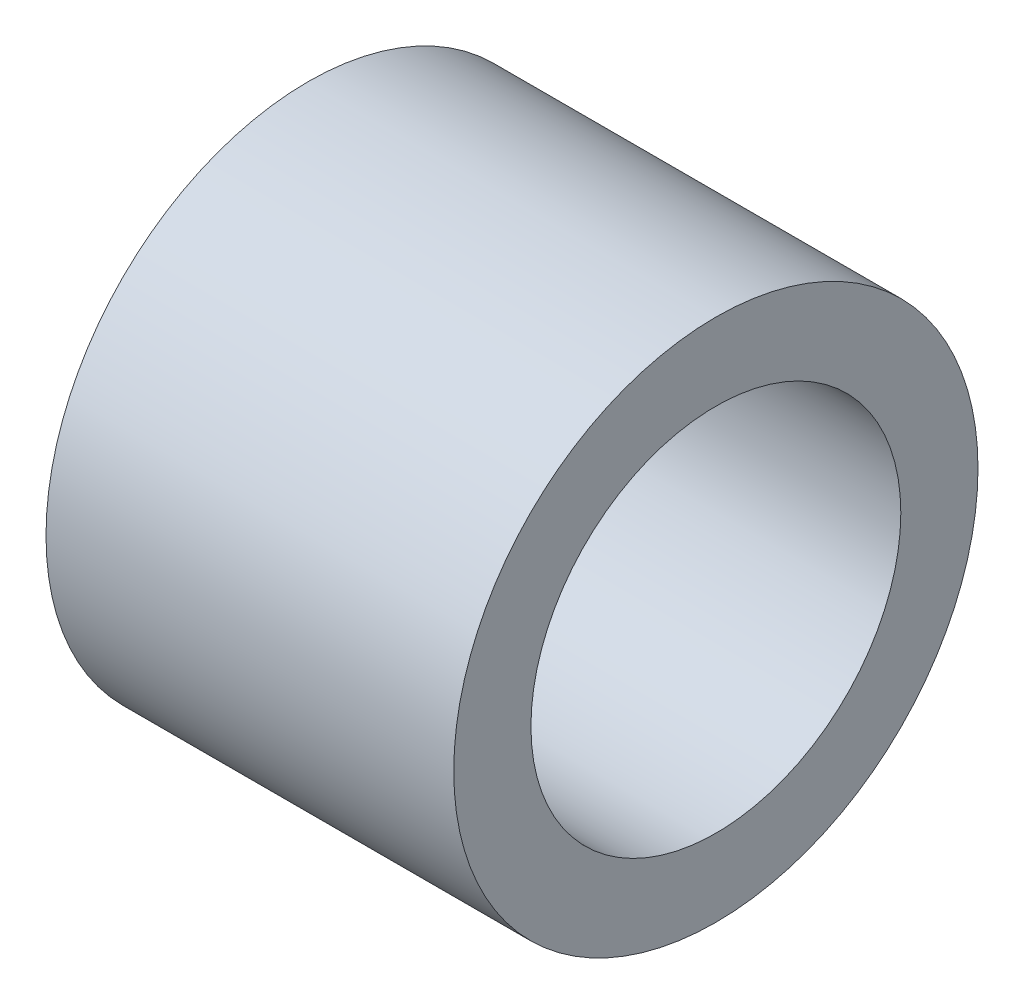
from build123d import *


with BuildPart() as part:
    # Axial profile (mm) → Full revolution (revolve)
    with BuildSketch(Plane.XY, mode=Mode.PRIVATE) as full_revolution_sk:
        Polygon((97, 2.4), (99, 2.4), (99, 3.175), (104, 3.175), (104, 4.5), (97, 4.5), align=None)
    revolve(full_revolution_sk.sketch.rotate(Axis((-110, 0, 0), (1, 0, 0)), 90), axis=Axis((-110, 0, 0), (1, 0, 0)))


solid = part.part
